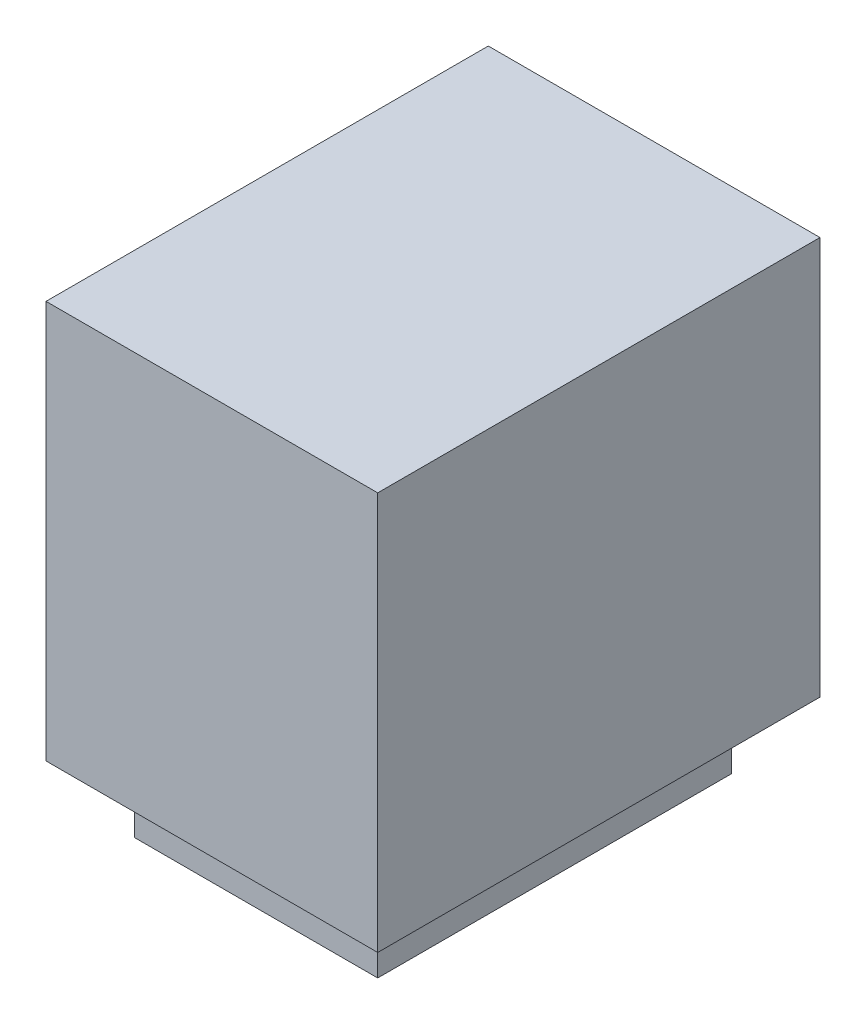
from build123d import *

# Parameters (mm, degrees)
SKETCH2_W           = 1500
SKETCH2_H           = 2000
BOSS_EXTRUDE1_DEPTH = 1800
SKETCH3_W           = 1100
SKETCH3_H           = 1600
BOSS_EXTRUDE2_DEPTH = 300
SKETCH4_W           = 900
SKETCH4_H           = 1200
CUT_EXTRUDE1_DEPTH  = 50
SKETCH5_W           = 600
SKETCH5_H           = 400
BOSS_EXTRUDE3_DEPTH = 50


with BuildPart() as part:
    # Sketch2 → Boss-Extrude1 (new body)
    with BuildSketch(Plane(origin=(0, 0, 0), x_dir=(1, 0, 0), z_dir=(0, 1, 0))):
        Rectangle(SKETCH2_W, SKETCH2_H)
    extrude(amount=BOSS_EXTRUDE1_DEPTH)

    # Sketch3 → Boss-Extrude2 (add)
    with BuildSketch(Plane(origin=(0, 0, 0), x_dir=(1, 0, 0), z_dir=(0, 1, 0))):
        Rectangle(SKETCH3_W, SKETCH3_H)
    extrude(amount=-BOSS_EXTRUDE2_DEPTH)

    # Sketch4 → Cut-Extrude1 (cut)
    with BuildSketch(Plane.XY):
        with Locations((-4.462739717, 900)):
            Rectangle(SKETCH4_W, SKETCH4_H)
    extrude(amount=CUT_EXTRUDE1_DEPTH, mode=Mode.SUBTRACT)

    # Sketch5 → Boss-Extrude3 (add)
    with BuildSketch(Plane.XY):
        with Locations((71.403835473, 918.76082198)):
            Rectangle(SKETCH5_W, SKETCH5_H)
    extrude(amount=-BOSS_EXTRUDE3_DEPTH)


solid = part.part
